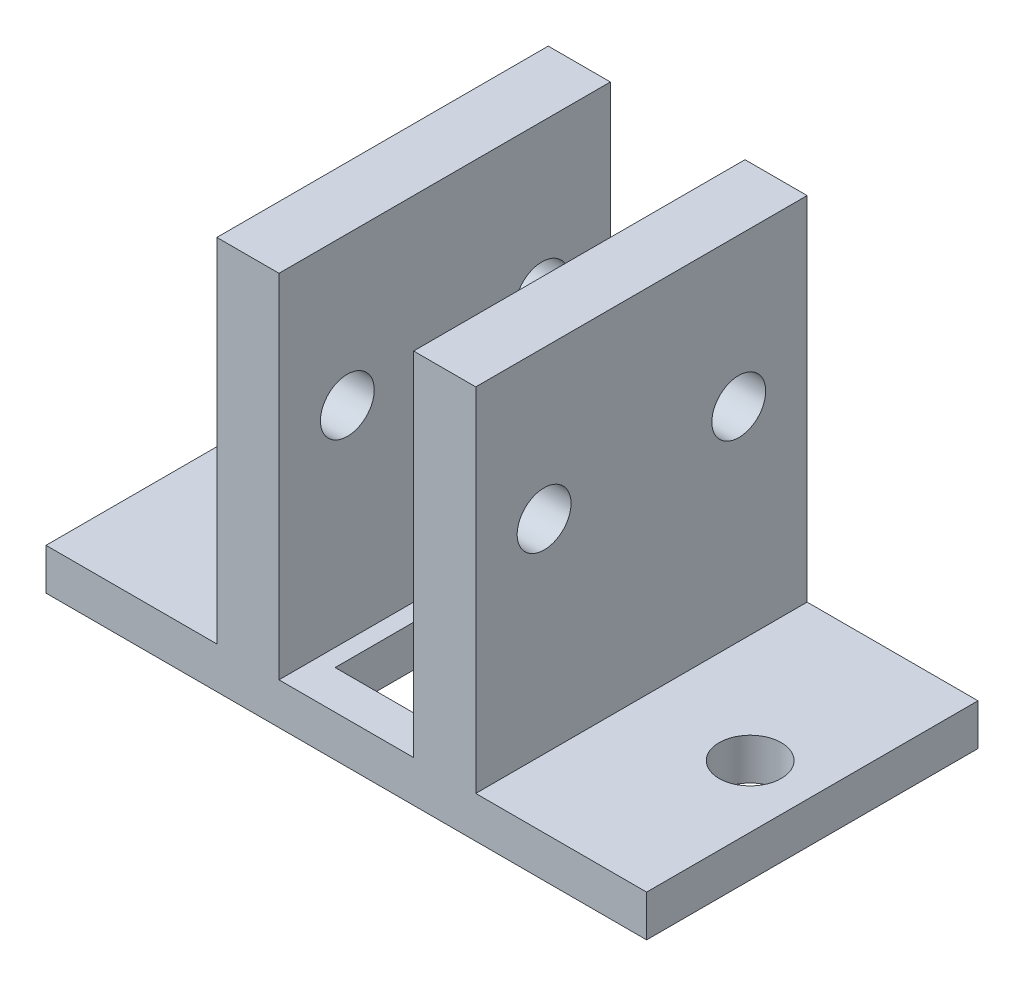
from build123d import *

# Parameters (mm, degrees)
CROQUIS1_W              = 29
CROQUIS1_H              = 16
CROQUIS1_R              = 1.5
SALIENTE_EXTRUIR1_DEPTH = 2
CROQUIS2_W              = 3
CROQUIS2_H              = 16
SALIENTE_EXTRUIR2_DEPTH = 17
CROQUIS3_R              = 1.3
CORTAR_EXTRUIR1_DEPTH   = 17
CROQUIS4_W              = 4.8184681
CROQUIS4_H              = 12.262383564
CORTAR_EXTRUIR2_DEPTH   = 10


with BuildPart() as part:
    # Croquis1 → Saliente-Extruir1 (new body)
    with BuildSketch(Plane(origin=(0, 0, 0), x_dir=(1, 0, 0), z_dir=(0, 1, 0))):
        Rectangle(CROQUIS1_W, CROQUIS1_H)
        with Locations(Location((11.5, 0, 0), (0, 0, 270))):
            Circle(CROQUIS1_R, mode=Mode.SUBTRACT)
        with Locations(Location((-11.5, 0, 0), (0, 0, 90))):
            Circle(CROQUIS1_R, mode=Mode.SUBTRACT)
    extrude(amount=SALIENTE_EXTRUIR1_DEPTH)

    # Croquis2 → Saliente-Extruir2 (add)
    with BuildSketch(Plane(origin=(0, 2, 0), x_dir=(1, 0, 0), z_dir=(0, 1, 0))):
        with Locations((4.75, 0)):
            Rectangle(CROQUIS2_W, CROQUIS2_H)
        with Locations((-4.75, 0)):
            Rectangle(CROQUIS2_W, CROQUIS2_H)
    extrude(amount=SALIENTE_EXTRUIR2_DEPTH)

    # Croquis3 → Cortar-Extruir1 (cut)
    with BuildSketch(Plane(origin=(6.25, 0, 0), x_dir=(0, 0, -1), z_dir=(1, 0, 0))):
        with Locations((-4.7, 11.829714682)):
            Circle(CROQUIS3_R)
        with Locations((4.7, 11.829714682)):
            Circle(CROQUIS3_R)
    extrude(amount=-CORTAR_EXTRUIR1_DEPTH, mode=Mode.SUBTRACT)

    # Croquis4 → Cortar-Extruir2 (cut)
    with BuildSketch(Plane(origin=(0, 2, 0), x_dir=(1, 0, 0), z_dir=(0, 1, 0))):
        Rectangle(CROQUIS4_W, CROQUIS4_H)
    extrude(amount=-CORTAR_EXTRUIR2_DEPTH, mode=Mode.SUBTRACT)


solid = part.part
